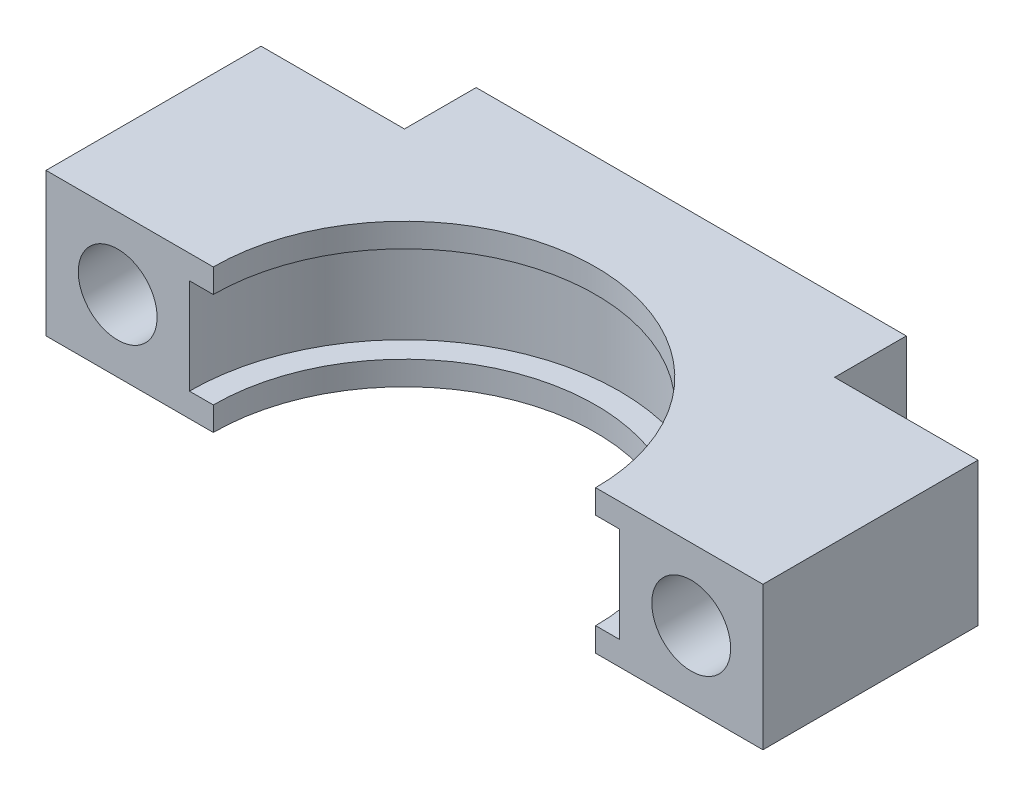
from build123d import *

# Parameters (mm, degrees)
SKETCH_1_W          = 30
SKETCH_1_H          = 12
EXTRUDE_1_DEPTH     = 6
SKETCH_3_W          = 6
SKETCH_3_H          = 6
CUT_EXTRUDE_1_DEPTH = 3
CUT_EXTRUDE_2_REACH = 20.493
SKETCH_4_R          = 1.65


with BuildPart() as part:
    # 草图1 → 凸台-拉伸1 (new body)
    with BuildSketch(Plane(origin=(0, 0, 0), x_dir=(1, 0, 0), z_dir=(0, 1, 0))):
        with Locations((0, 6)):
            Rectangle(SKETCH_1_W, SKETCH_1_H)
    extrude(amount=EXTRUDE_1_DEPTH)

    # 草图2 → 切除-旋转1 (revolve, cut)
    with BuildSketch(Plane.XY):
        Polygon((-8, 0), (0, 0), (0, 3), (-9, 3), (-9, 1), (-8, 1), align=None)
        Polygon((-9, 3), (0, 3), (0, 6), (-8, 6), (-8, 5), (-9, 5), align=None)
    revolve(axis=Axis((0, 0, 0), (0, 1, 0)), mode=Mode.SUBTRACT)

    # 草图3 → 切除-拉伸1 (cut)
    with BuildSketch(Plane(origin=(0, 0, -12), x_dir=(-1, 0, 0), z_dir=(0, 0, -1))):
        with Locations((-12, 3)):
            Rectangle(SKETCH_3_W, SKETCH_3_H)
    cut_extrude_1 = extrude(amount=-CUT_EXTRUDE_1_DEPTH, mode=Mode.SUBTRACT)

    # 草图4 → 切除-拉伸2 (cut, up to next)
    with BuildSketch(Plane(origin=(0, 0, -9), x_dir=(-1, 0, 0), z_dir=(0, 0, -1)), mode=Mode.PRIVATE) as cut_extrude_2_sk1:
        with Locations((-12, 3)):
            Circle(SKETCH_4_R)
    cut_extrude_2_tool1 = extrude(cut_extrude_2_sk1.sketch, amount=-CUT_EXTRUDE_2_REACH, mode=Mode.PRIVATE) & part.part
    cut_extrude_2 = cut_extrude_2_tool1.solids().sort_by_distance((12, 3, -9))[0]
    add(cut_extrude_2, mode=Mode.SUBTRACT)

    # 镜向1: 切除-拉伸1, 切除-拉伸2 across plane
    add(cut_extrude_1.mirror(Plane(origin=(0, 0, 0), x_dir=(0, 0, 1), z_dir=(1, 0, 0))), mode=Mode.SUBTRACT)
    add(cut_extrude_2.mirror(Plane(origin=(0, 0, 0), x_dir=(0, 0, 1), z_dir=(1, 0, 0))), mode=Mode.SUBTRACT)


solid = part.part
